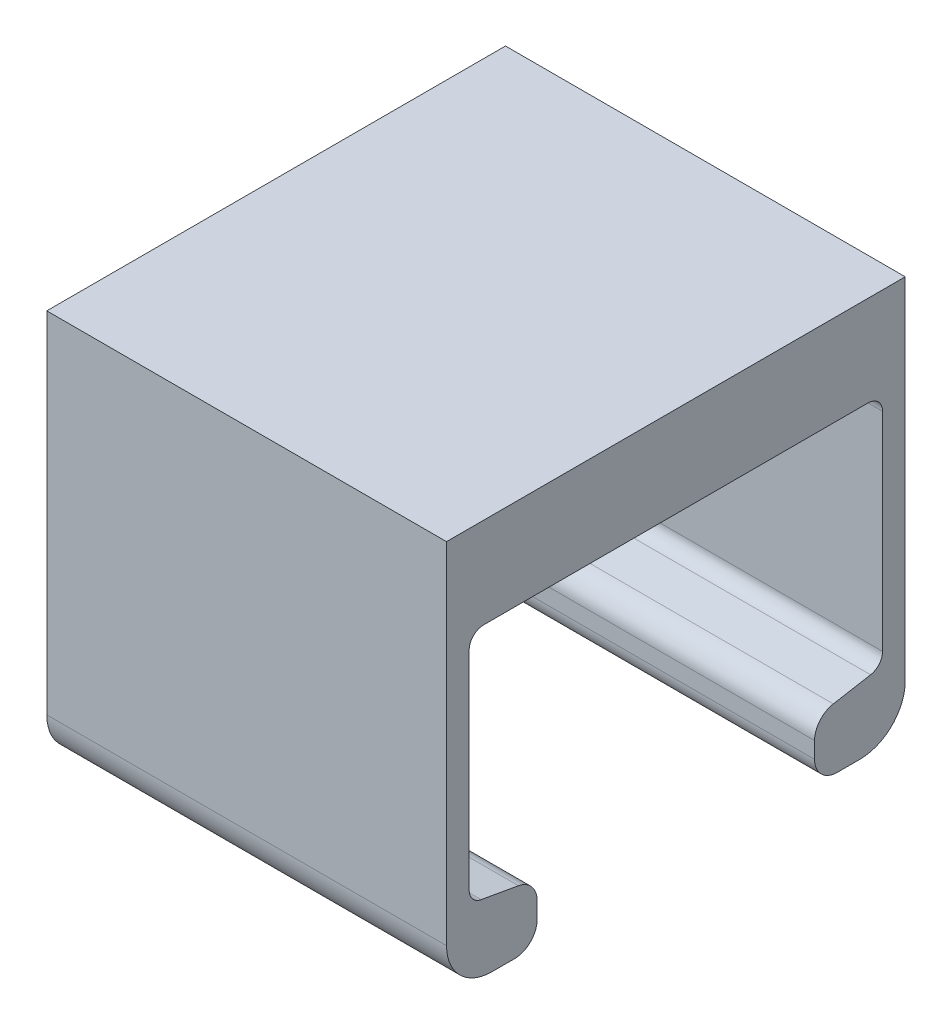
from build123d import *

# Parameters (mm, degrees)
BOSS_EXTRUDE1_DEPTH      = 14
BOSS_EXTRUDE1_DEPTH_BACK = 14
FILLET2_R                = 3.175
FILLET3_R                = 1.016
FILLET4_R                = 1.5875
SKETCH3_R                = 9.0297
CUT_EXTRUDE1_DEPTH       = 3.048


with BuildPart() as part:
    # Sketch1 → Boss-Extrude1 (new, two sides: drawn at the far end of the back side and taken through both)
    with BuildSketch(Plane(origin=(0, 0, 0), x_dir=(0, 0, -1), z_dir=(1, 0, 0)).offset(-BOSS_EXTRUDE1_DEPTH_BACK)):
        Polygon((-16.0655, -10.325348422), (-9.7155, -10.325348422), (-9.7155, -6.263815771), (-14.478, -5.424058525), (-14.478, 11.008), (0, 11.008), (14.478, 11.008), (14.478, -5.424058525), (9.7155, -6.263815771), (9.7155, -10.325348422), (16.0655, -10.325348422), (16.0655, 17.358), (0, 17.358), (-16.0655, 17.358), align=None)
    extrude(amount=BOSS_EXTRUDE1_DEPTH + BOSS_EXTRUDE1_DEPTH_BACK)

    # Fillet2
    fillet2_edges = [part.edges().sort_by_distance(p)[0] for p in [
        (0, -10.325348422, 16.0655),
        (0, -10.325348422, -16.0655),
    ]]
    fillet(fillet2_edges, radius=FILLET2_R)

    # Fillet3
    fillet3_edges = [part.edges().sort_by_distance(p)[0] for p in [
        (0, -5.424058525, -14.478),
        (0, 11.008, -14.478),
        (0, 11.008, 14.478),
        (0, -5.424058525, 14.478),
    ]]
    fillet(fillet3_edges, radius=FILLET3_R)

    # Fillet4
    fillet4_edges = [part.edges().sort_by_distance(p)[0] for p in [
        (0, -6.263815771, 9.7155),
        (0, -10.325348422, 9.7155),
        (0, -10.325348422, -9.7155),
        (0, -6.263815771, -9.7155),
    ]]
    fillet(fillet4_edges, radius=FILLET4_R)

    # Sketch3 → Cut-Extrude1 (cut)
    with BuildSketch(Plane(origin=(0, 11.008, 0), x_dir=(-1, 0, 0), z_dir=(0, -1, 0))):
        with Locations(Location((0, 0, 0), (0, 0, 90))):
            Circle(SKETCH3_R)
    extrude(amount=-CUT_EXTRUDE1_DEPTH, mode=Mode.SUBTRACT)


solid = part.part
